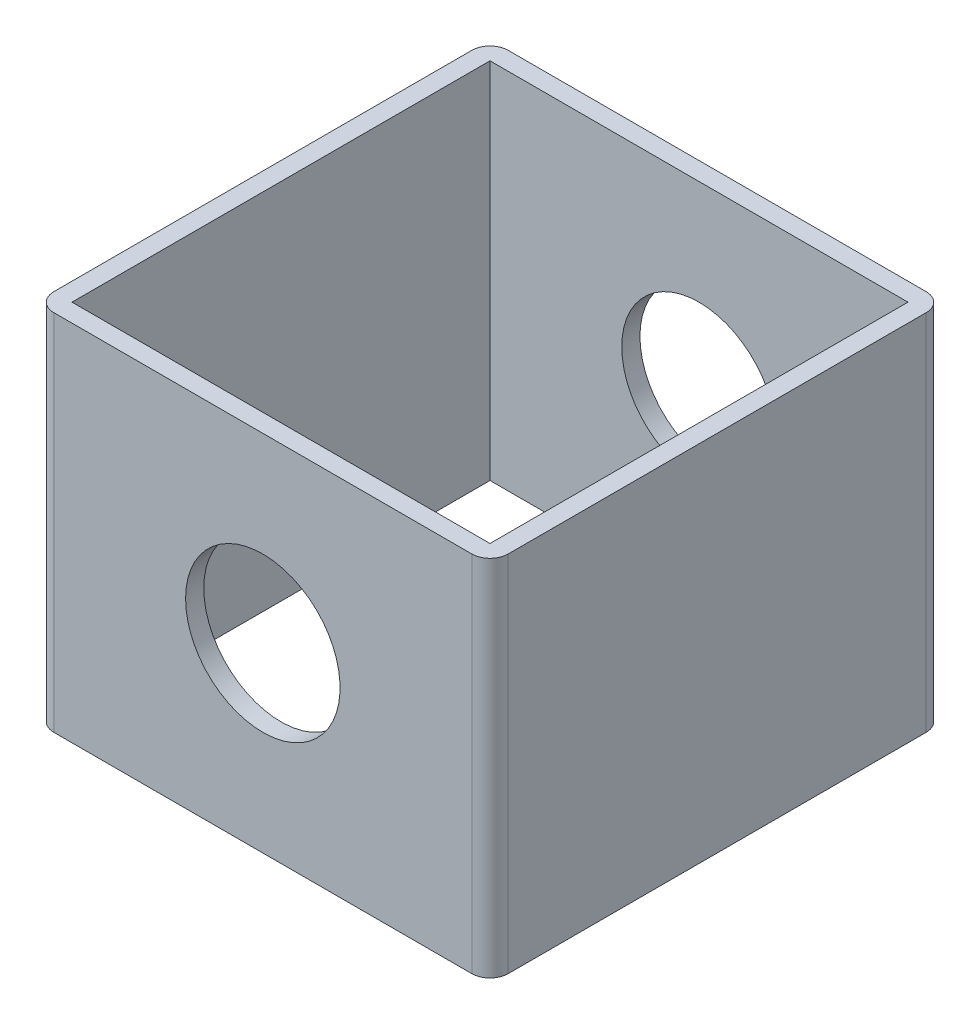
from build123d import *

# Parameters (mm, degrees)
SKETCH1_W               = 46
SKETCH1_H               = 46
EXTRUDE_THIN1_DEPTH     = 20
CUT_EXTRUDE1_DEPTH      = 58.697486947
CUT_EXTRUDE1_DEPTH_BACK = 58.697486947
SKETCH2_R               = 8.5


with BuildPart() as part:
    # Sketch1 → Extrude-Thin1 (new, symmetric)
    with BuildSketch(Plane(origin=(0, 0, 0), x_dir=(1, 0, 0), z_dir=(0, 1, 0))):
        with BuildLine():
            Line((-23, 25), (23, 25))
            ThreePointArc((23, 25), (24.414213562, 24.414213562), (25, 23))
            Line((25, 23), (25, -23))
            ThreePointArc((25, -23), (24.414213562, -24.414213562), (23, -25))
            Line((23, -25), (-23, -25))
            ThreePointArc((-23, -25), (-24.414213562, -24.414213562), (-25, -23))
            Line((-25, -23), (-25, 23))
            ThreePointArc((-25, 23), (-24.414213562, 24.414213562), (-23, 25))
        make_face()
        Rectangle(SKETCH1_W, SKETCH1_H, mode=Mode.SUBTRACT)
    extrude(amount=EXTRUDE_THIN1_DEPTH, both=True)

    # Sketch2 → Cut-Extrude1 (cut, two sides: drawn at the far end of the back side and taken through both)
    with BuildSketch(Plane(origin=(0, 0, 23), x_dir=(-1, 0, 0), z_dir=(0, 0, -1)).offset(-CUT_EXTRUDE1_DEPTH_BACK)):
        Circle(SKETCH2_R)
    extrude(amount=CUT_EXTRUDE1_DEPTH + CUT_EXTRUDE1_DEPTH_BACK, mode=Mode.SUBTRACT)


solid = part.part
